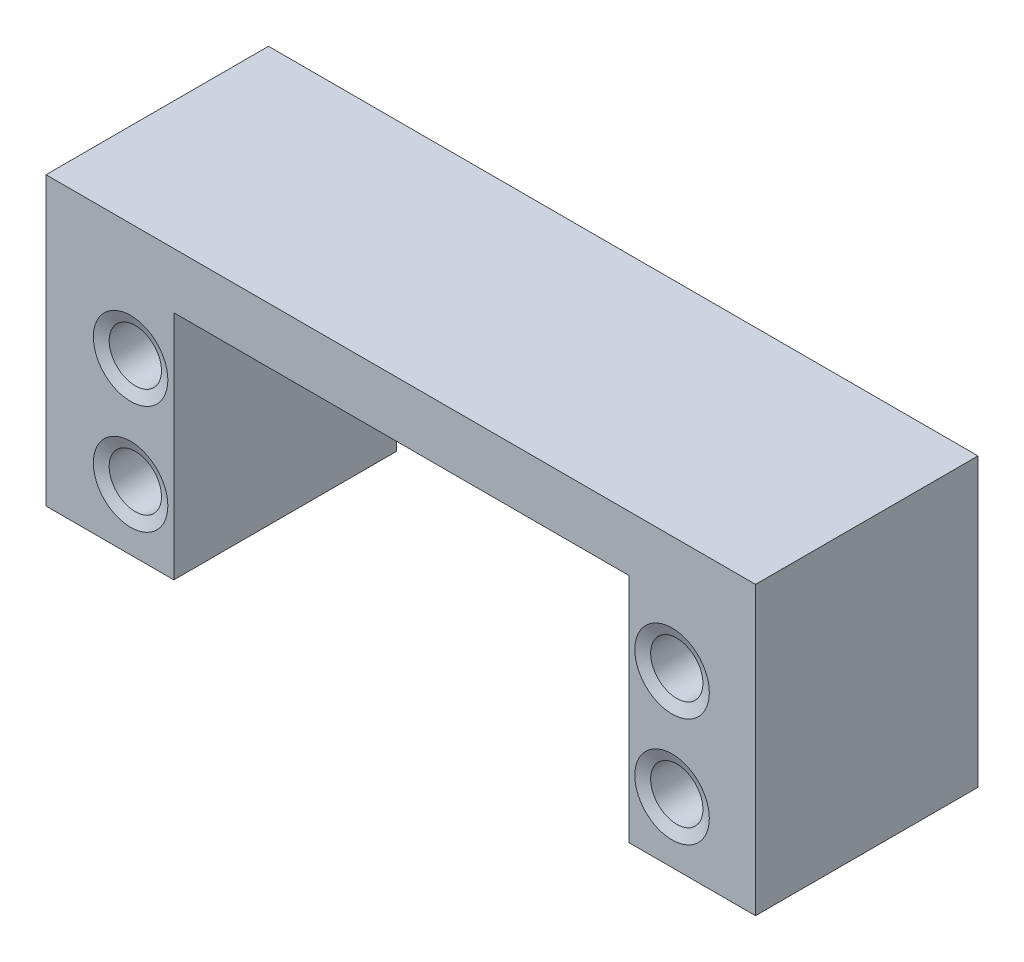
from build123d import *

# Parameters (mm, degrees)
SKETCH1_W           = 18.495
SKETCH1_H           = 20.8
SKETCH1_W_2         = 10
SKETCH1_W_3         = 37.395
BOSS_EXTRUDE1_DEPTH = 20
SKETCH6_W           = 106.79
SKETCH6_H           = 20
BOSS_EXTRUDE4_DEPTH = 5
SKETCH9_R           = 2.35
CUT_EXTRUDE1_DEPTH  = 10
SKETCH10_W          = 20
SKETCH10_H          = 25.8
CUT_EXTRUDE2_DEPTH  = 17
SKETCH11_W          = 20
SKETCH11_H          = 25.8
CUT_EXTRUDE3_DEPTH  = 26
CHAMFER1_SIZE       = 1
CHAMFER1_SIZE2      = 0.424474816


with BuildPart() as part:
    # Sketch1 → Boss-Extrude1 (new body)
    with BuildSketch(Plane.XY):
        with Locations((-39.1475, 0)):
            Rectangle(SKETCH1_W, SKETCH1_H)
        with Locations((-53.395, 0)):
            Rectangle(SKETCH1_W_2, SKETCH1_H)
        with Locations((29.6975, 0)):
            Rectangle(SKETCH1_W_3, SKETCH1_H)
    extrude(amount=BOSS_EXTRUDE1_DEPTH)

    # Sketch6 → Boss-Extrude4 (add)
    with BuildSketch(Plane(origin=(0, 10.4, 0), x_dir=(1, 0, 0), z_dir=(0, 1, 0))):
        with Locations((-5, -10)):
            Rectangle(SKETCH6_W, SKETCH6_H)
    extrude(amount=BOSS_EXTRUDE4_DEPTH)

    # Sketch9 → Cut-Extrude1 (cut)
    with BuildSketch(Plane.XY.offset(20)):
        with Locations((14.89, -4.9)):
            Circle(SKETCH9_R)
        with Locations(Location((14.89, 4.9, 0), (0, 0, 180))):
            Circle(SKETCH9_R)
        with Locations(Location((-33.79, -4.9, 0), (0, 0, 180))):
            Circle(SKETCH9_R)
        with Locations((-33.79, 4.9)):
            Circle(SKETCH9_R)
    extrude(amount=-CUT_EXTRUDE1_DEPTH, mode=Mode.SUBTRACT)

    # Sketch10 → Cut-Extrude2 (cut)
    with BuildSketch(Plane.ZY.offset(58.395)):
        with Locations((10, 2.5)):
            Rectangle(SKETCH10_W, SKETCH10_H)
    extrude(amount=-CUT_EXTRUDE2_DEPTH, mode=Mode.SUBTRACT)

    # Sketch11 → Cut-Extrude3 (cut)
    with BuildSketch(Plane(origin=(48.395, 0, 0), x_dir=(0, 0, -1), z_dir=(1, 0, 0))):
        with Locations((-10, 2.5)):
            Rectangle(SKETCH11_W, SKETCH11_H)
    extrude(amount=-CUT_EXTRUDE3_DEPTH, mode=Mode.SUBTRACT)

    # Chamfer1
    chamfer1_edges = [part.edges().sort_by_distance(p)[0] for p in [
        (17.24, 4.9, 20),
        (-31.44, -4.9, 20),
        (-36.14, 4.9, 20),
        (12.54, -4.9, 20),
    ]]
    chamfer1_side = [part.faces().sort_by_distance(p)[0] for p in [
        (-35.6475, -9.711900872, 20),
    ]]
    chamfer(chamfer1_edges, length=CHAMFER1_SIZE, length2=CHAMFER1_SIZE2, reference=chamfer1_side[0])


solid = part.part
